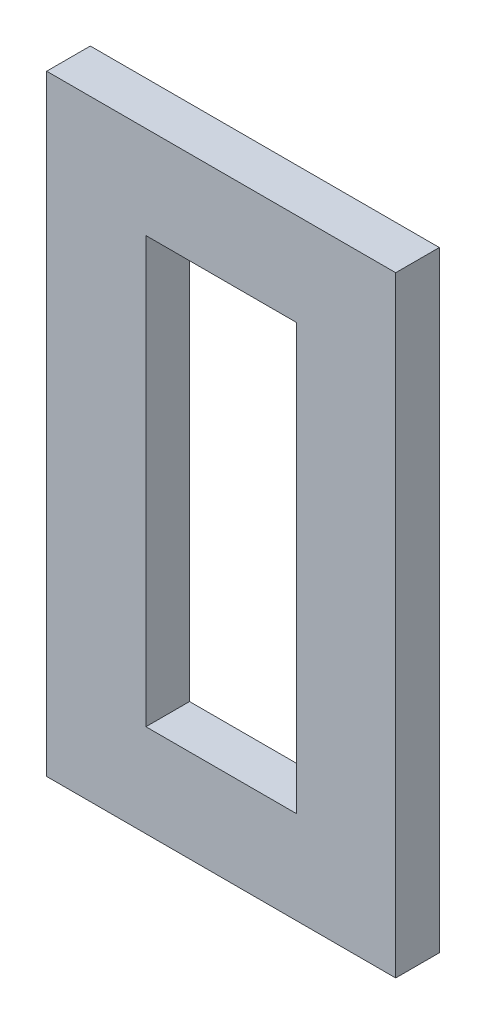
from build123d import *

# Parameters (mm, degrees)
SKETCH1_W           = 160
SKETCH1_H           = 280
SKETCH1_W_2         = 69
SKETCH1_H_2         = 195
BOSS_EXTRUDE1_DEPTH = 20


with BuildPart() as part:
    # Sketch1 → Boss-Extrude1 (new body)
    with BuildSketch(Plane.XY):
        with Locations((-211.827956989, 0)):
            Rectangle(SKETCH1_W, SKETCH1_H)
        with Locations((-211.827956989, 0)):
            Rectangle(SKETCH1_W_2, SKETCH1_H_2, mode=Mode.SUBTRACT)
    extrude(amount=BOSS_EXTRUDE1_DEPTH)


solid = part.part
